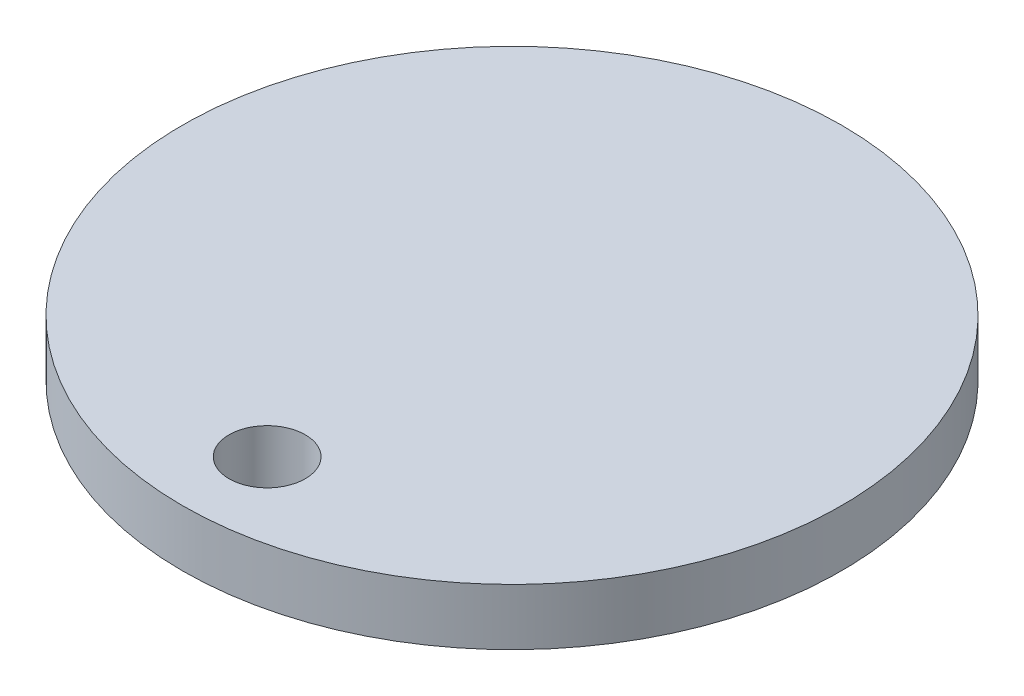
from build123d import *

# Parameters (mm, degrees)
SKETCH_2_R      = 17.5
SKETCH_2_R_2    = 2.025
EXTRUDE_1_DEPTH = 3


with BuildPart() as part:
    # 草图2 → 凸台-拉伸1 (new body)
    with BuildSketch(Plane(origin=(0, 0, 0), x_dir=(1, 0, 0), z_dir=(0, 1, 0))):
        with Locations(Location((0, 0, 0), (0, 0, 270))):
            Circle(SKETCH_2_R)
        with Locations(Location((0, -13.002191227, 0), (0, 0, 270))):
            Circle(SKETCH_2_R_2, mode=Mode.SUBTRACT)
    extrude(amount=EXTRUDE_1_DEPTH)


solid = part.part
